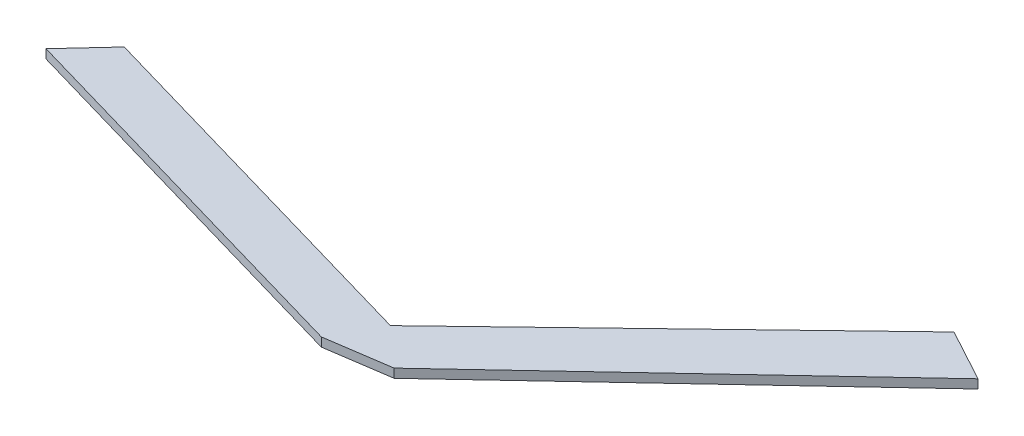
from build123d import *

# Parameters (mm, degrees)
BOSS_EXTRUDE1_DEPTH = 1


with BuildPart() as part:
    # Sketch1 → Boss-Extrude1 (new body)
    with BuildSketch(Plane(origin=(0, 0, 0), x_dir=(1, 0, 0), z_dir=(0, 1, 0))):
        Polygon((0, 0), (-42.269633497, 12.217941072), (-46.517533008, 7.633418224), (-2.806889278, -5.001043566), (4.364929398, -3.939197594), (38.368207388, 27.969014295), (32.436679192, 31.190733287), align=None)
    extrude(amount=BOSS_EXTRUDE1_DEPTH)


solid = part.part
